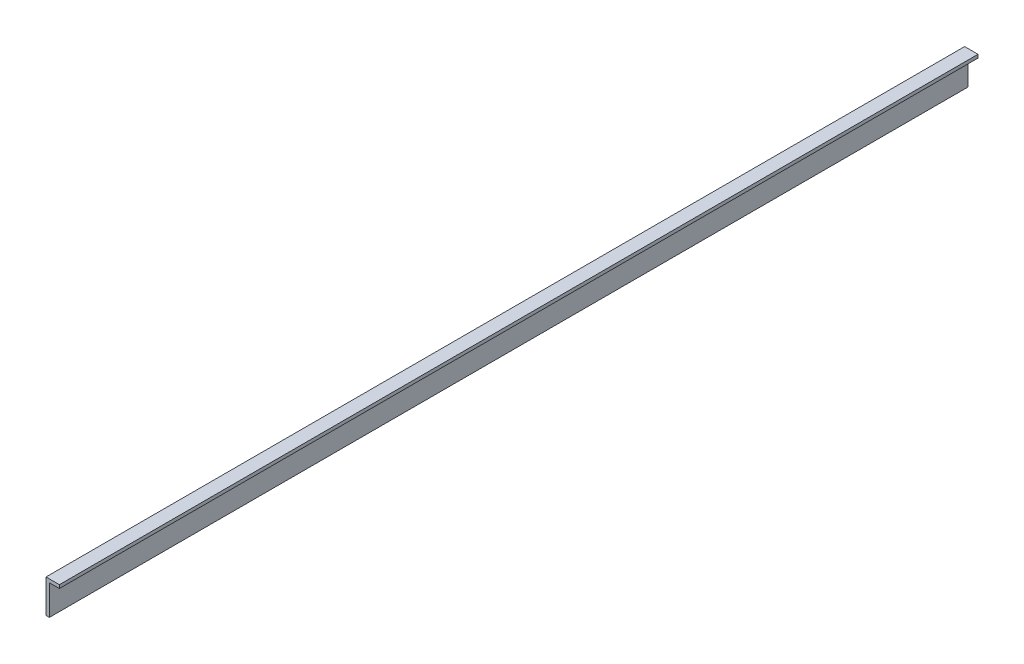
from build123d import *

# Parameters (mm, degrees)
OVEN_YAG_KABI_L_RAF_SOL_1_START = -30
OVEN_YAG_KABI_L_RAF_SOL_1_DEPTH = 550


with BuildPart() as part:
    # Sketch1 → OVEN_yag_kabi_L_raf_sol_1 (new body)
    with BuildSketch(Plane.XY.offset(OVEN_YAG_KABI_L_RAF_SOL_1_START)):
        Polygon((56, 870), (54, 870), (54, 890), (62, 890), (62, 888), (56, 888), align=None)
    extrude(amount=-OVEN_YAG_KABI_L_RAF_SOL_1_DEPTH)


solid = part.part
